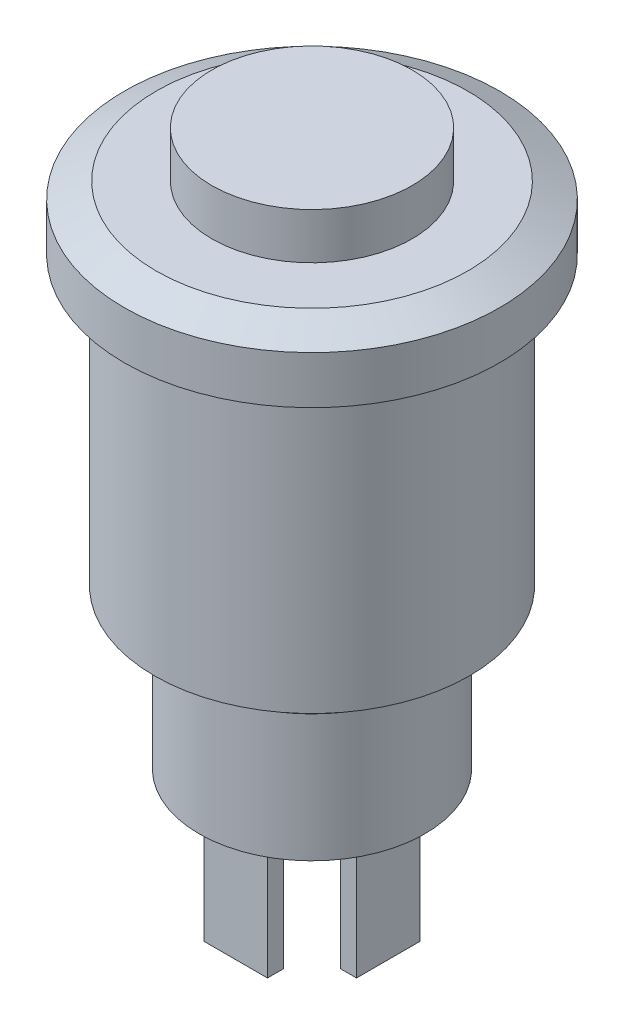
from build123d import *

# Parameters (mm, degrees)
ESQUISSE2_W                  = 2
ESQUISSE2_H                  = 0.5
BOSS_EXTRU_1_DEPTH           = 4
R_P_TITION_CIRCULAIRE1_COUNT = 4


with BuildPart() as part:
    # Esquisse1 → Révolution1 (revolve)
    with BuildSketch(Plane.XY, mode=Mode.PRIVATE) as r_volution1_sk:
        Polygon((0, 3.45), (-3.15, 3.45), (-3.15, 2), (-4.9, 2), (-5.9, 1.5), (-5.9, 0), (-4.95, 0), (-4.95, -9), (-3.55, -10), (-3.55, -14), (0, -14), align=None)
    revolve(r_volution1_sk.sketch.rotate(Axis((0, 55, 0), (0, -1, 0)), 270), axis=Axis((0, 55, 0), (0, -1, 0)))

    # Esquisse2 → Boss.-Extru.1 (add)
    with BuildSketch(Plane.XZ.offset(14)):
        with Locations((0, 2.15)):
            Rectangle(ESQUISSE2_W, ESQUISSE2_H)
    boss_extru_1 = extrude(amount=BOSS_EXTRU_1_DEPTH)

    # Répétition circulaire1: Boss.-Extru.1 ×4 about axis
    r_p_tition_circulaire1_axis = Axis((0, 0, 0), (0, 1, 0))
    for i in range(1, R_P_TITION_CIRCULAIRE1_COUNT):
        add(boss_extru_1.rotate(r_p_tition_circulaire1_axis, i * 360 / R_P_TITION_CIRCULAIRE1_COUNT))


solid = part.part
